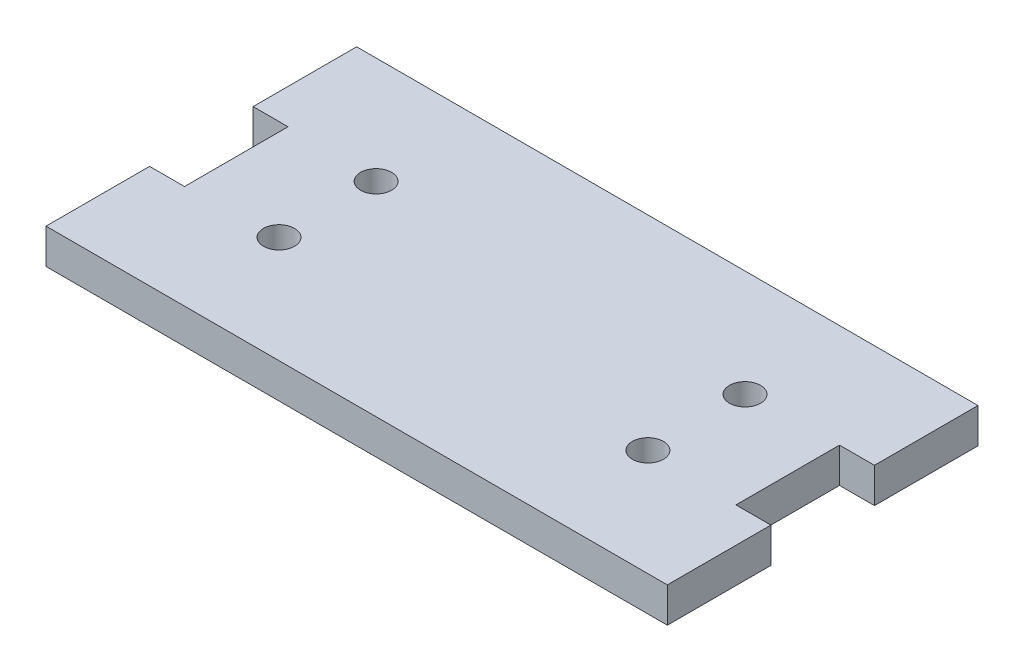
from build123d import *

# Parameters (mm, degrees)
SKETCH1_R           = 4
BOSS_EXTRUDE1_DEPTH = 9


with BuildPart() as part:
    # Sketch1 → Boss-Extrude1 (new body)
    with BuildSketch(Plane(origin=(0, 0, 0), x_dir=(1, 0, 0), z_dir=(0, 1, 0))):
        Polygon((0, 26.666666667), (0, 0), (160, 0), (160, 26.666666667), (151, 26.666666667), (151, 53.333333333), (160, 53.333333333), (160, 80), (0, 80), (0, 53.333333333), (9, 53.333333333), (9, 26.666666667), align=None)
        with Locations(Location((127.5, 52.5, 0), (0, 0, 270))):
            Circle(SKETCH1_R, mode=Mode.SUBTRACT)
        with Locations(Location((32.5, 27.5, 0), (0, 0, 270))):
            Circle(SKETCH1_R, mode=Mode.SUBTRACT)
        with Locations(Location((127.5, 27.5, 0), (0, 0, 270))):
            Circle(SKETCH1_R, mode=Mode.SUBTRACT)
        with Locations(Location((32.5, 52.5, 0), (0, 0, 270))):
            Circle(SKETCH1_R, mode=Mode.SUBTRACT)
    extrude(amount=BOSS_EXTRUDE1_DEPTH)


solid = part.part
